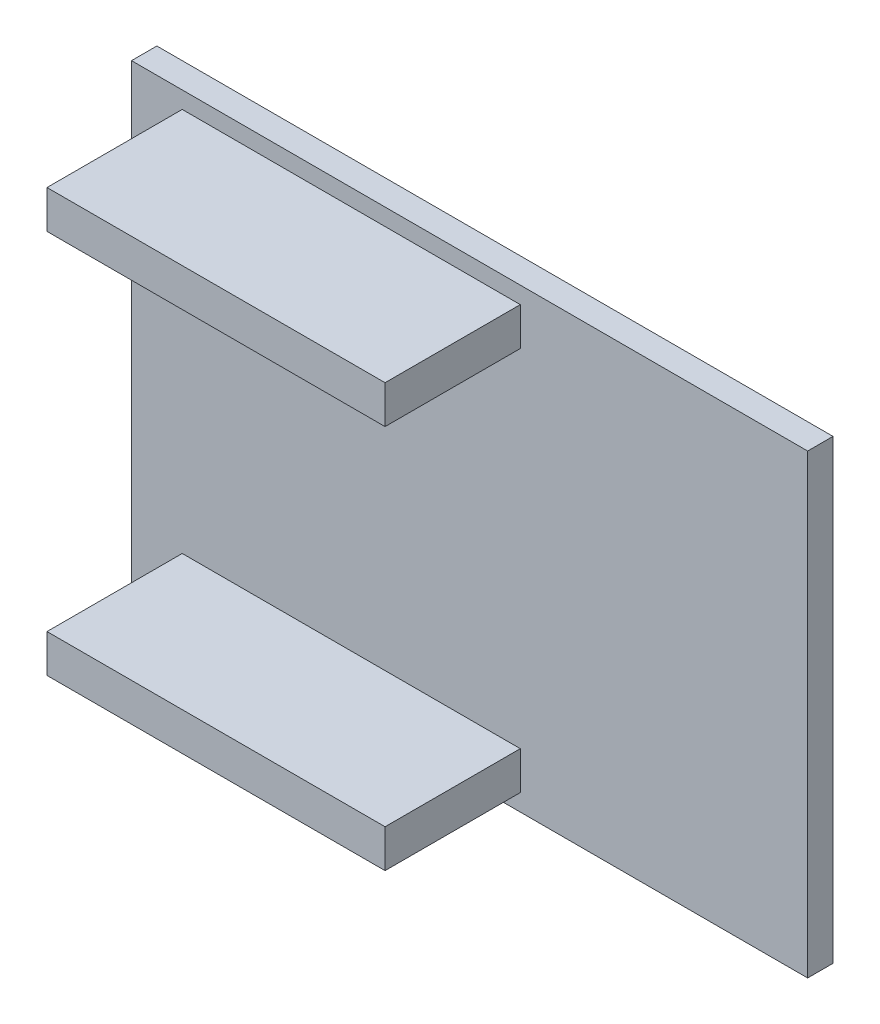
from build123d import *

# Parameters (mm, degrees)
SKETCH1_W           = 40
SKETCH1_H           = 27
BOSS_EXTRUDE1_DEPTH = 1.5
SKETCH2_W           = 20
SKETCH2_H           = 2.25
BOSS_EXTRUDE2_DEPTH = 8


with BuildPart() as part:
    # Sketch1 → Boss-Extrude1 (new body)
    with BuildSketch(Plane.XY):
        Rectangle(SKETCH1_W, SKETCH1_H)
    extrude(amount=BOSS_EXTRUDE1_DEPTH)

    # Sketch2 → Boss-Extrude2 (add)
    with BuildSketch(Plane.XY.offset(1.5)):
        with Locations((-7, 11.375)):
            Rectangle(SKETCH2_W, SKETCH2_H)
        with Locations((-7, -11.375)):
            Rectangle(SKETCH2_W, SKETCH2_H)
    extrude(amount=BOSS_EXTRUDE2_DEPTH)


solid = part.part
